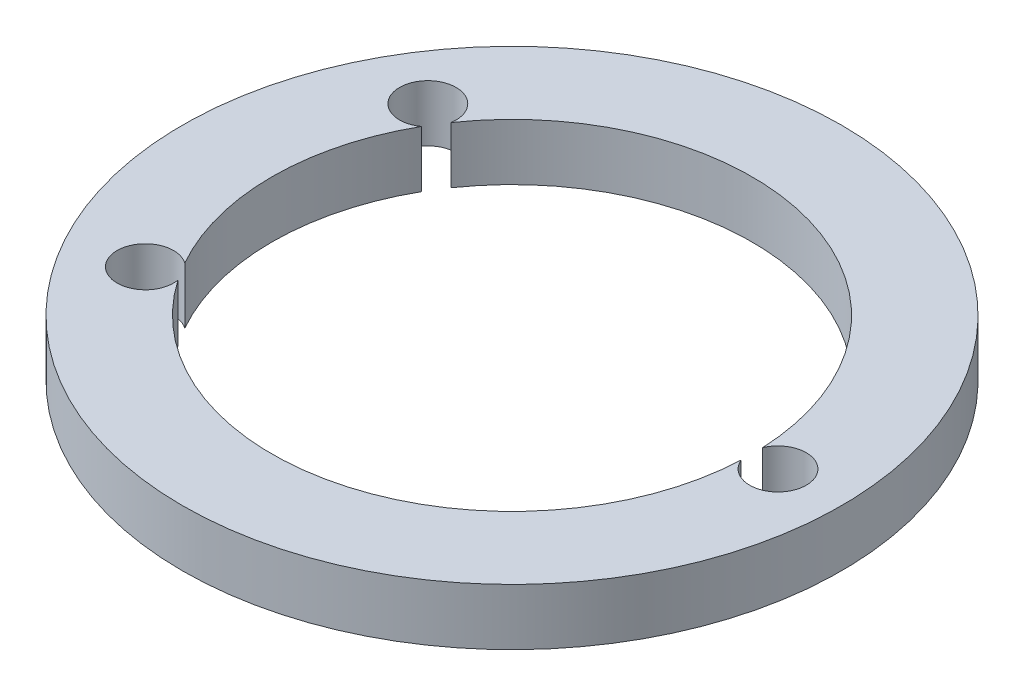
from build123d import *

# Parameters (mm, degrees)
SKETCH_1_R      = 35
EXTRUDE_1_DEPTH = 6


with BuildPart() as part:
    # 草图1 → 凸台-拉伸1 (new body)
    with BuildSketch(Plane(origin=(0, 0, 0), x_dir=(1, 0, 0), z_dir=(0, 1, 0))):
        with Locations(Location((0, 0, 0), (0, 0, 270))):
            Circle(SKETCH_1_R)
        with BuildLine():
            ThreePointArc((-20.982160881, 14.491339648), (-26.480889225, 16.592920354), (-22.19153101, 12.561287809))
            ThreePointArc((-22.19153101, 12.561287809), (-25.5, 0), (-22.19153101, -12.561287809))
            ThreePointArc((-22.19153101, -12.561287809), (-26.480889225, -16.592920354), (-20.982160881, -14.491339648))
            ThreePointArc((-20.982160881, -14.491339648), (7.04399237, -24.507798177), (25.474557522, -1.138823539))
            ThreePointArc((25.474557522, -1.138823539), (31.25, 0), (25.474557522, 1.138823539))
            ThreePointArc((25.474557522, 1.138823539), (7.04399237, 24.507798177), (-20.982160881, 14.491339648))
        make_face(mode=Mode.SUBTRACT)
    extrude(amount=EXTRUDE_1_DEPTH)


solid = part.part
